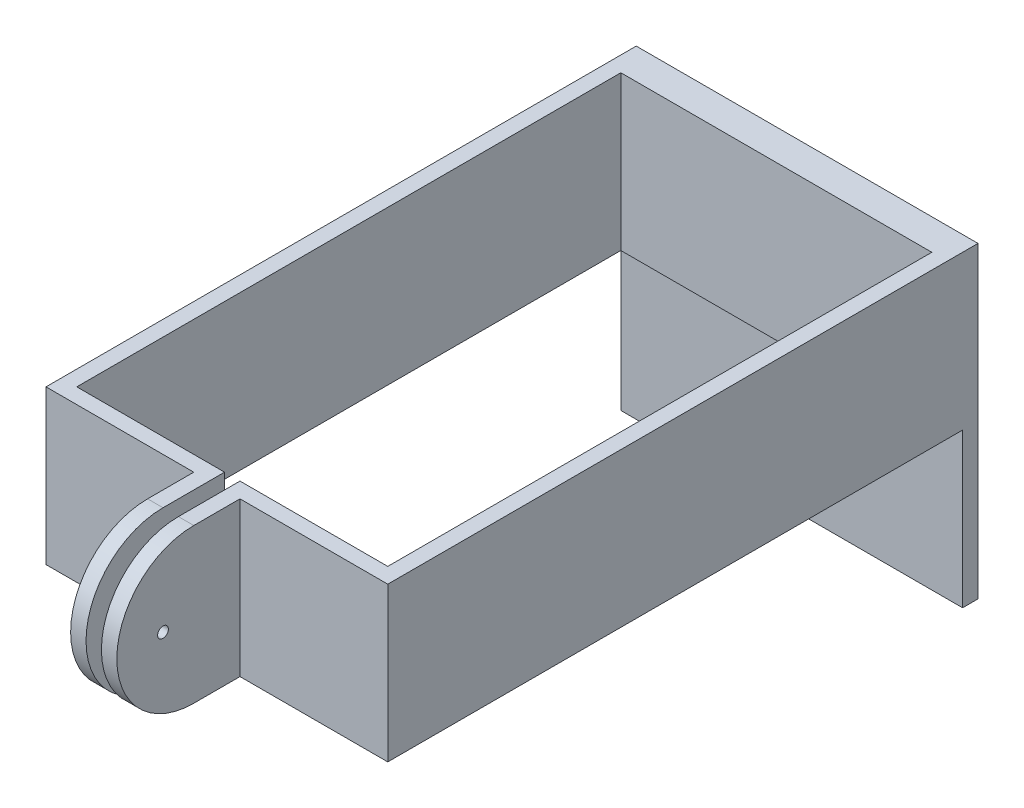
from build123d import *

# Parameters (mm, degrees)
BOSS_EXTRUDE1_DEPTH = 50
FILLET1_RADIUS      = 25
FILLET1_LENGTH      = 5
FILLET2_RADIUS      = 25
FILLET2_LENGTH      = 5
SKETCH2_W           = 111
SKETCH2_H           = 100
BOSS_EXTRUDE2_DEPTH = 5
SKETCH3_R           = 1.75
CUT_EXTRUDE1_DEPTH  = 204.28770253
SKETCH4_R           = 5
CUT_EXTRUDE2_DEPTH  = 256.203624582


with BuildPart() as part:
    # Sketch1 → Boss-Extrude1 (new body)
    with BuildSketch(Plane(origin=(0, 0, 0), x_dir=(1, 0, 0), z_dir=(0, 1, 0))):
        Polygon((0, 0), (0, 176.7), (101, 176.7), (101, 0), (53, 0), (53, -5), (53, -45), (58, -45), (58, -5), (106, -5), (106, 181.7), (-5, 181.7), (-5, -5), (43, -5), (43, -45), (48, -45), (48, -5), (48, 0), align=None)
    extrude(amount=BOSS_EXTRUDE1_DEPTH)

    # Fillet1: full round fillet: the end face becomes a half cylinder, R = half its width
    fillet1_face = Plane((45.5, 25, 45), x_dir=(1, 0, 0), z_dir=(0, 0, 1))  # on the end face: x along it, z out of the body
    fillet1_slab = fillet1_face.offset(-FILLET1_RADIUS / 2) * Box(FILLET1_LENGTH, 2 * FILLET1_RADIUS, FILLET1_RADIUS, mode=Mode.PRIVATE)  # the body's end, R deep
    fillet1_round = Plane((45.5, 25, 20), x_dir=(0, 0, 1), z_dir=(1, 0, 0)) * Cylinder(FILLET1_RADIUS, FILLET1_LENGTH, mode=Mode.PRIVATE)  # its axis R under the face
    add(fillet1_slab - fillet1_round, mode=Mode.SUBTRACT)

    # Fillet2: full round fillet: the end face becomes a half cylinder, R = half its width
    fillet2_face = Plane((55.5, 25, 45), x_dir=(1, 0, 0), z_dir=(0, 0, 1))  # on the end face: x along it, z out of the body
    fillet2_slab = fillet2_face.offset(-FILLET2_RADIUS / 2) * Box(FILLET2_LENGTH, 2 * FILLET2_RADIUS, FILLET2_RADIUS, mode=Mode.PRIVATE)  # the body's end, R deep
    fillet2_round = Plane((55.5, 25, 20), x_dir=(0, 0, 1), z_dir=(1, 0, 0)) * Cylinder(FILLET2_RADIUS, FILLET2_LENGTH, mode=Mode.PRIVATE)  # its axis R under the face
    add(fillet2_slab - fillet2_round, mode=Mode.SUBTRACT)

    # Sketch2 → Boss-Extrude2 (add)
    with BuildSketch(Plane(origin=(0, 0, -181.7), x_dir=(-1, 0, 0), z_dir=(0, 0, -1))):
        with Locations((-50.5, 0)):
            Rectangle(SKETCH2_W, SKETCH2_H)
    extrude(amount=BOSS_EXTRUDE2_DEPTH)

    # Sketch3 → Cut-Extrude1 (cut, through all)
    with BuildSketch(Plane.ZY.offset(-43)):
        with Locations((30, 25)):
            Circle(SKETCH3_R)
    extrude(amount=-CUT_EXTRUDE1_DEPTH, mode=Mode.SUBTRACT)

    # Sketch4 → Cut-Extrude2 (cut, through all)
    with BuildSketch(Plane.XY.offset(-181.7)):
        with Locations((50.5, -30)):
            Circle(SKETCH4_R)
    extrude(amount=-CUT_EXTRUDE2_DEPTH, mode=Mode.SUBTRACT)


solid = part.part
